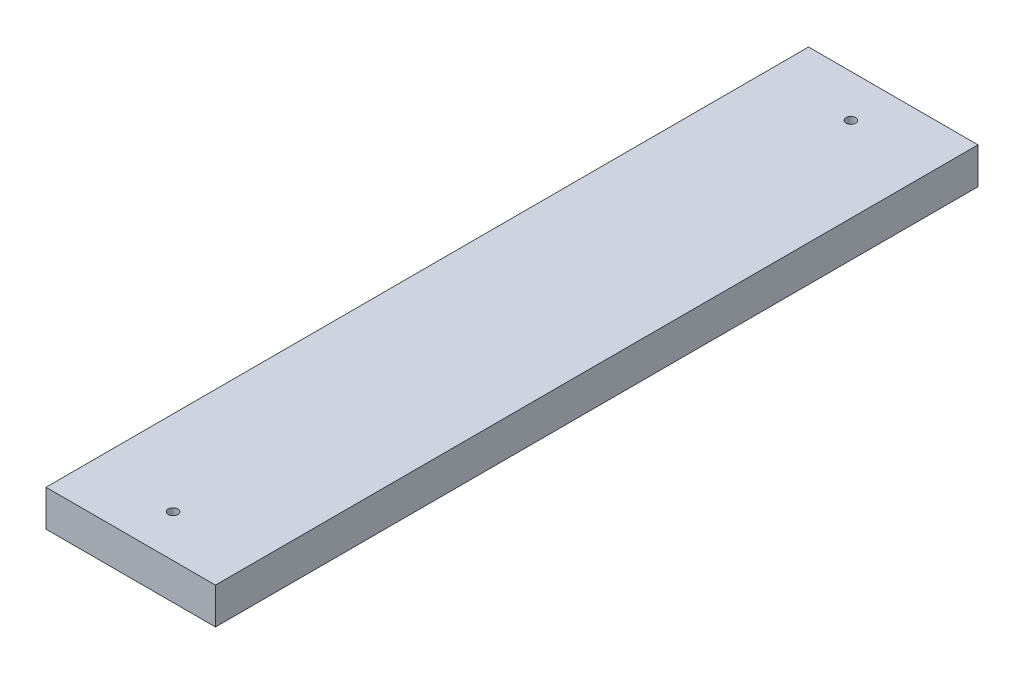
from build123d import *

# Parameters (mm, degrees)
SKETCH1_W           = 70
SKETCH1_H           = 315
SKETCH1_R           = 2
BOSS_EXTRUDE1_DEPTH = 15


with BuildPart() as part:
    # Sketch1 → Boss-Extrude1 (new body)
    with BuildSketch(Plane(origin=(0, 0, 0), x_dir=(1, 0, 0), z_dir=(0, 1, 0))):
        Rectangle(SKETCH1_W, SKETCH1_H)
        with Locations(Location((0, 140, 0), (0, 0, 270))):
            Circle(SKETCH1_R, mode=Mode.SUBTRACT)
        with Locations(Location((0, -140, 0), (0, 0, 270))):
            Circle(SKETCH1_R, mode=Mode.SUBTRACT)
    extrude(amount=BOSS_EXTRUDE1_DEPTH)


solid = part.part
